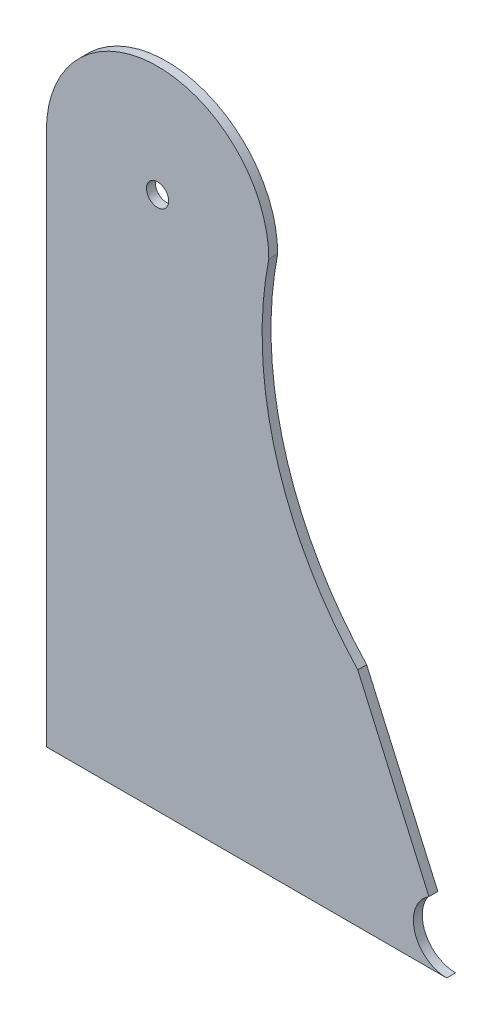
from build123d import *

# Parameters (mm, degrees)
SKETCH1_R           = 3.175
BOSS_EXTRUDE1_DEPTH = 2.54


with BuildPart() as part:
    # Sketch1 → Boss-Extrude1 (new body)
    with BuildSketch(Plane.XY):
        with BuildLine():
            Line((0, 0), (-114.3, 0))
            Line((-114.3, 0), (-114.3, 152.4))
            ThreePointArc((-114.3, 152.4), (-82.55, 184.15), (-50.8, 152.4))
            ThreePointArc((-50.8, 152.4), (-48.798325541, 104.89333556), (-25.4, 63.5))
            Line((-25.4, 63.5), (-5.08, 17.582246738))
            ThreePointArc((-5.08, 17.582246738), (-9.150707628, 6.881106109), (0, 0))
        make_face()
        with Locations((-82.55, 152.4)):
            Circle(SKETCH1_R, mode=Mode.SUBTRACT)
    extrude(amount=BOSS_EXTRUDE1_DEPTH)


solid = part.part
